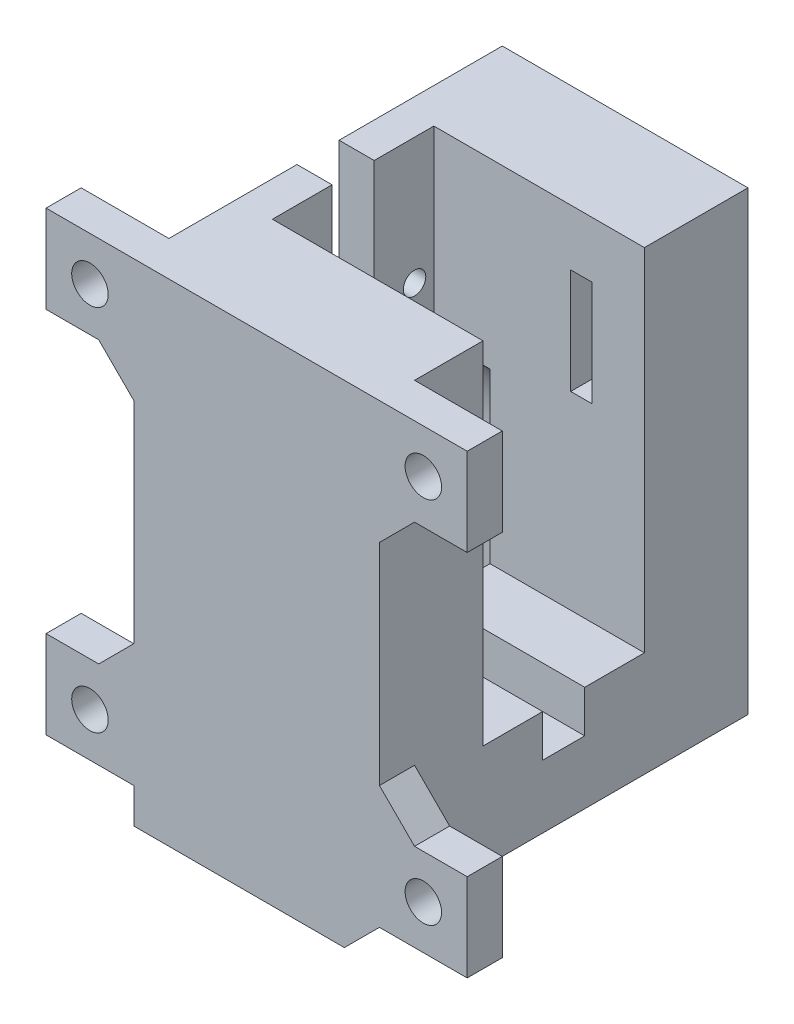
from build123d import *

# Parameters (mm, degrees)
BOSS_EXTRUDE1_DEPTH      = 42.5
BOSS_EXTRUDE1_DEPTH_BACK = 15
SKETCH1_W                = 40
SKETCH1_H                = 65
SKETCH3_W                = 22.5
SKETCH3_H                = 50
CUT_EXTRUDE2_DEPTH       = 30
SKETCH4_R                = 4.5
CUT_EXTRUDE3_DEPTH       = 10
SKETCH6_W                = 40
SKETCH6_H                = 65
CUT_EXTRUDE4_DEPTH       = 5
SKETCH7_R                = 3.1
CUT_EXTRUDE5_DEPTH       = 10
SKETCH8_W                = 52.5
SKETCH8_H                = 65
CUT_EXTRUDE6_DEPTH       = 5
SKETCH9_W                = 12.5
SKETCH9_H                = 12.5
SKETCH9_R                = 2.6
BOSS_EXTRUDE2_DEPTH      = 5
BOSS_EXTRUDE3_START      = 5
SKETCH10_R               = 3.1
BOSS_EXTRUDE3_DEPTH      = 5
SKETCH11_R               = 1.6
CUT_EXTRUDE7_DEPTH       = 87.240941553
CUT_EXTRUDE8_DEPTH       = 11.5
CUT_EXTRUDE8_DEPTH_BACK  = 11.5
SKETCH12_W               = 30
SKETCH12_H               = 50
CUT_EXTRUDE9_DEPTH       = 30
CUT_EXTRUDE10_DEPTH      = 15
CUT_EXTRUDE11_START      = -13
SKETCH15_R               = 17
SKETCH15_R_2             = 4.5
CUT_EXTRUDE11_DEPTH      = 13
CHAMFER1_SIZE            = 1
SKETCH16_W               = 9.25
SKETCH16_H               = 10
CUT_EXTRUDE12_DEPTH      = 2
SKETCH17_R               = 2.1
BOSS_EXTRUDE4_DEPTH      = 5
CHAMFER2_SIZE            = 5
CHAMFER3_SIZE            = 5
CHAMFER4_SIZE            = 5
SKETCH18_W               = 3
SKETCH18_H               = 15
CUT_EXTRUDE13_DEPTH      = 40.75
SKETCH20_R               = 1.2
BOSS_EXTRUDE5_DEPTH      = 5


with BuildPart() as part:
    # Sketch1 → Boss-Extrude1 (new, two sides: drawn at the far end of the back side and taken through both)
    with BuildSketch(Plane.XY.offset(-BOSS_EXTRUDE1_DEPTH_BACK)):
        with Locations((20, 32.5)):
            Rectangle(SKETCH1_W, SKETCH1_H)
    extrude(amount=BOSS_EXTRUDE1_DEPTH + BOSS_EXTRUDE1_DEPTH_BACK)

    # Sketch3 → Cut-Extrude2 (cut)
    with BuildSketch(Plane(origin=(40, 0, 0), x_dir=(0, 0, -1), z_dir=(1, 0, 0))):
        with Locations((-11.25, 40)):
            Rectangle(SKETCH3_W, SKETCH3_H)
    extrude(amount=-CUT_EXTRUDE2_DEPTH, mode=Mode.SUBTRACT)

    # Sketch4 → Cut-Extrude3 (cut)
    with BuildSketch(Plane(origin=(10, 0, 0), x_dir=(0, 0, -1), z_dir=(1, 0, 0))):
        with Locations((-11.25, 26.5)):
            Circle(SKETCH4_R)
    extrude(amount=-CUT_EXTRUDE3_DEPTH, mode=Mode.SUBTRACT)

    # Sketch6 → Cut-Extrude4 (cut)
    with BuildSketch(Plane.XY.offset(42.5)):
        with Locations((20, 32.5)):
            Rectangle(SKETCH6_W, SKETCH6_H)
    extrude(amount=-CUT_EXTRUDE4_DEPTH, mode=Mode.SUBTRACT)

    # Sketch7 → Cut-Extrude5 (cut)
    with BuildSketch(Plane.XZ):
        with Locations(Location((28, 25.5, 0), (0, 0, 270))):
            Circle(SKETCH7_R)
        with Locations(Location((28, -3, 0), (0, 0, 270))):
            Circle(SKETCH7_R)
    extrude(amount=-CUT_EXTRUDE5_DEPTH, mode=Mode.SUBTRACT)

    # Sketch8 → Cut-Extrude6 (cut)
    with BuildSketch(Plane.ZY):
        with Locations((11.25, 32.5)):
            Rectangle(SKETCH8_W, SKETCH8_H)
    extrude(amount=-CUT_EXTRUDE6_DEPTH, mode=Mode.SUBTRACT)

    # Sketch9 → Boss-Extrude2 (add)
    # profile 1 of 4: a face of its own
    with BuildSketch(Plane.XY.offset(37.5)):
        with Locations((-1.25, 58.75)):
            Rectangle(SKETCH9_W, SKETCH9_H)
        with Locations((-1.25, 58.75)):
            Circle(SKETCH9_R, mode=Mode.SUBTRACT)
    # profile 2 of 4: a face of its own
    with BuildSketch(Plane.XY.offset(37.5)):
        with Locations((46.25, 58.75)):
            Rectangle(SKETCH9_W, SKETCH9_H)
        with Locations(Location((46.25, 58.75, 0), (0, 0, 180))):
            Circle(SKETCH9_R, mode=Mode.SUBTRACT)
    # profile 3 of 4: a face of its own
    with BuildSketch(Plane.XY.offset(37.5)):
        with Locations((46.25, 6.25)):
            Rectangle(SKETCH9_W, SKETCH9_H)
        with Locations((46.25, 6.25)):
            Circle(SKETCH9_R, mode=Mode.SUBTRACT)
    # profile 4 of 4: a face of its own
    with BuildSketch(Plane.XY.offset(37.5)):
        with Locations((-1.25, 6.25)):
            Rectangle(SKETCH9_W, SKETCH9_H)
        with Locations(Location((-1.25, 6.25, 0), (0, 0, 180))):
            Circle(SKETCH9_R, mode=Mode.SUBTRACT)
    extrude(amount=-BOSS_EXTRUDE2_DEPTH)

    # Sketch10 → Boss-Extrude3 (add)
    with BuildSketch(Plane.XZ.offset(BOSS_EXTRUDE3_START)):
        Polygon((40, 32.5), (40, 37.5), (5, 37.5), (5, -15), (40, -15), align=None)
        with Locations(Location((28, 25.5, 0), (0, 0, 270))):
            Circle(SKETCH10_R, mode=Mode.SUBTRACT)
        with Locations(Location((28, -3, 0), (0, 0, 270))):
            Circle(SKETCH10_R, mode=Mode.SUBTRACT)
    extrude(amount=-BOSS_EXTRUDE3_DEPTH)

    # Sketch11 → Cut-Extrude7 (cut, through all)
    with BuildSketch(Plane(origin=(10, 0, 0), x_dir=(0, 0, -1), z_dir=(1, 0, 0))):
        with Locations((-2.5, 47)):
            Circle(SKETCH11_R)
        with Locations((-20, 47)):
            Circle(SKETCH11_R)
    extrude(amount=-CUT_EXTRUDE7_DEPTH, mode=Mode.SUBTRACT)

    # Sketch12 → Cut-Extrude8 (cut, two sides: drawn at the far end of the back side and taken through both)
    with BuildSketch(Plane(origin=(0, 0, 11.25), x_dir=(-1, 0, 0), z_dir=(0, 0, -1)).offset(-CUT_EXTRUDE8_DEPTH_BACK)):
        with Locations((-25, 40)):
            Rectangle(SKETCH12_W, SKETCH12_H)
    extrude(amount=CUT_EXTRUDE8_DEPTH + CUT_EXTRUDE8_DEPTH_BACK, mode=Mode.SUBTRACT)

    # Sketch13 → Cut-Extrude9 (cut)
    with BuildSketch(Plane(origin=(40, 0, 0), x_dir=(0, 0, -1), z_dir=(1, 0, 0))):
        Polygon((-11.25, 15), (-8.25, 15), (-8.25, 9), (-14.25, 9), (-14.25, 15), align=None)
    extrude(amount=-CUT_EXTRUDE9_DEPTH, mode=Mode.SUBTRACT)

    # Sketch14 → Cut-Extrude10 (cut)
    with BuildSketch(Plane(origin=(0, 65, 0), x_dir=(1, 0, 0), z_dir=(0, 1, 0))):
        Polygon((5, -11.25), (5, -8.25), (10, -8.25), (10, -14.25), (5, -14.25), align=None)
    extrude(amount=-CUT_EXTRUDE10_DEPTH, mode=Mode.SUBTRACT)

    # Sketch15 → Cut-Extrude11 (cut)
    # profile 1 of 2: a face of its own
    with BuildSketch(Plane.ZY.offset(-5).offset(CUT_EXTRUDE11_START)):
        with Locations((11.25, 26.5)):
            Circle(SKETCH15_R)
        with Locations((11.25, 26.5)):
            Circle(SKETCH15_R_2, mode=Mode.SUBTRACT)
    # profile 2 of 2: a face of its own
    with BuildSketch(Plane.ZY.offset(-5).offset(CUT_EXTRUDE11_START)):
        with BuildLine():
            Line((-5.75, 26.5), (-5.75, -5))
            Line((-5.75, -5), (28.25, -5))
            Line((28.25, -5), (28.25, 26.5))
            ThreePointArc((28.25, 26.5), (11.25, 9.5), (-5.75, 26.5))
        make_face()
    extrude(amount=CUT_EXTRUDE11_DEPTH, mode=Mode.SUBTRACT)

    # Chamfer1
    chamfer1_edges = [part.edges().sort_by_distance(p)[0] for p in [
        (5, 10.75, -5.75),
        (5, 43.5, 11.25),
        (5, 10.75, 28.25),
    ]]
    chamfer(chamfer1_edges, length=CHAMFER1_SIZE)

    # Sketch16 → Cut-Extrude12 (cut)
    with BuildSketch(Plane.ZY.offset(-5)):
        with Locations((-10.375, 0)):
            Rectangle(SKETCH16_W, SKETCH16_H)
    extrude(amount=-CUT_EXTRUDE12_DEPTH, mode=Mode.SUBTRACT)

    # Sketch17 → Boss-Extrude4 (add)
    # profile 1 of 3: a face of its own
    with BuildSketch(Plane(origin=(69.218616892, 6.6, 8.180920591), x_dir=(-1, 0, 0), z_dir=(0, -1, 0))):
        Polygon((51.218616892, 7.230920591), (51.218616892, 2.230920591), (56.218616892, 2.230920591), align=None)
    # profile 2 of 3: a face of its own
    with BuildSketch(Plane(origin=(69.218616892, 6.6, 8.180920591), x_dir=(-1, 0, 0), z_dir=(0, -1, 0))):
        Polygon((56.218616892, -9.769079409), (51.218616892, -9.769079409), (51.218616892, -14.569079409), align=None)
    # profile 3 of 3: a face of its own
    with BuildSketch(Plane(origin=(69.218616892, 6.6, 8.180920591), x_dir=(-1, 0, 0), z_dir=(0, -1, 0))):
        Polygon((56.218616892, 2.230920591), (51.218616892, 2.230920591), (51.218616892, -9.769079409), (56.218616892, -9.769079409), (82.218616892, -9.769079409), (82.218616892, 2.230920591), align=None)
        with Locations(Location((56.721116892, -3.069079409, 0), (0, 0, 180))):
            Circle(SKETCH17_R, mode=Mode.SUBTRACT)
        with Locations(Location((76.541116892, -3.069079409, 0), (0, 0, 180))):
            Circle(SKETCH17_R, mode=Mode.SUBTRACT)
    extrude(amount=BOSS_EXTRUDE4_DEPTH)

    # Chamfer2
    chamfer2_edges = [part.edges().sort_by_distance(p)[0] for p in [
        (40, -5, 11.25),
    ]]
    chamfer(chamfer2_edges, length=CHAMFER2_SIZE)

    # Chamfer3
    chamfer3_edges = [part.edges().sort_by_distance(p)[0] for p in [
        (40, 52.5, 35),
        (40, 12.5, 35),
    ]]
    chamfer(chamfer3_edges, length=CHAMFER3_SIZE)

    # Chamfer4
    chamfer4_edges = [part.edges().sort_by_distance(p)[0] for p in [
        (5, 12.5, 35),
        (5, 52.5, 35),
    ]]
    chamfer(chamfer4_edges, length=CHAMFER4_SIZE)

    # Sketch18 → Cut-Extrude13 (cut)
    with BuildSketch(Plane(origin=(0, 0, -15), x_dir=(-1, 0, 0), z_dir=(0, 0, -1))):
        with Locations((-31, 49.5)):
            Rectangle(SKETCH18_W, SKETCH18_H)
    extrude(amount=-CUT_EXTRUDE13_DEPTH, mode=Mode.SUBTRACT)

    # Sketch20 → Boss-Extrude5 (add)
    with BuildSketch(Plane.ZY.offset(-17)):
        Polygon((-15, -3.25), (-35, -3.2), (-35, 6.7), (-15, 6.7), align=None)
        with Locations((-29.75, 3.9)):
            Circle(SKETCH20_R, mode=Mode.SUBTRACT)
        with Locations((-20.15, 3.9)):
            Circle(SKETCH20_R, mode=Mode.SUBTRACT)
    extrude(amount=BOSS_EXTRUDE5_DEPTH)


solid = part.part
